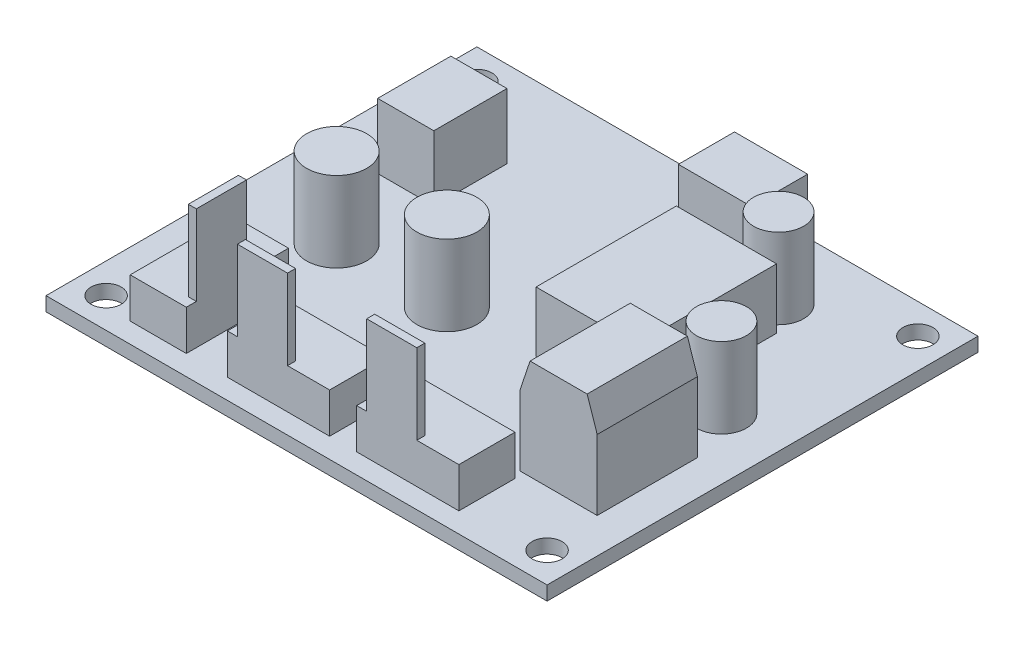
from build123d import *
from OCP.BRepFilletAPI import BRepFilletAPI_MakeChamfer

# Parameters (mm, degrees)
ESQUISSE1_W          = 50
ESQUISSE1_H          = 43
ESQUISSE1_R          = 1.5
BOSS_EXTRU_1_DEPTH   = 1.4
ESQUISSE3_W          = 5.6
ESQUISSE3_H          = 10.2
BOSS_EXTRU_2_DEPTH   = 4
ESQUISSE3_W_2        = 10.2
ESQUISSE3_H_2        = 5.6
BOSS_EXTRU_2_2_DEPTH = 4
BOSS_EXTRU_2_3_DEPTH = 4
ESQUISSE4_W          = 5.6
ESQUISSE4_H          = 7.3
BOSS_EXTRU_3_DEPTH   = 6.5
ESQUISSE4_W_2        = 7.3
ESQUISSE4_H_2        = 5.6
BOSS_EXTRU_3_2_DEPTH = 6.5
ESQUISSE5_W          = 10
ESQUISSE5_H          = 14
BOSS_EXTRU_4_DEPTH   = 6
ESQUISSE6_W          = 7.7
ESQUISSE6_H          = 10
BOSS_EXTRU_5_DEPTH   = 10
ESQUISSE7_R          = 2.5
BOSS_EXTRU_6_DEPTH   = 8
BOSS_EXTRU_6_2_DEPTH = 8
ESQUISSE8_R          = 3
BOSS_EXTRU_7_DEPTH   = 8
BOSS_EXTRU_7_2_DEPTH = 8
ESQUISSE9_W          = 0.8
ESQUISSE9_H          = 5
ESQUISSE9_W_2        = 5
ESQUISSE9_H_2        = 0.8
BOSS_EXTRU_8_DEPTH   = 8
CHANFREIN1_SIZE      = 3
CHANFREIN1_SIZE2     = 1


with BuildPart() as part:
    # Esquisse1 → Boss.-Extru.1 (new body)
    with BuildSketch(Plane(origin=(0, 0, 0), x_dir=(1, 0, 0), z_dir=(0, 1, 0))):
        Rectangle(ESQUISSE1_W, ESQUISSE1_H)
        with Locations(Location((-22, 18.5, 0), (0, 0, 270))):
            Circle(ESQUISSE1_R, mode=Mode.SUBTRACT)
        with Locations(Location((22, 18.5, 0), (0, 0, 90))):
            Circle(ESQUISSE1_R, mode=Mode.SUBTRACT)
        with Locations(Location((22, -18.5, 0), (0, 0, 270))):
            Circle(ESQUISSE1_R, mode=Mode.SUBTRACT)
        with Locations(Location((-22, -18.5, 0), (0, 0, 90))):
            Circle(ESQUISSE1_R, mode=Mode.SUBTRACT)
    extrude(amount=BOSS_EXTRU_1_DEPTH)


with BuildPart() as body_2:
    # Esquisse3 → Boss.-Extru.2 (new body)
    with BuildSketch(Plane(origin=(0, 1.4, 0), x_dir=(1, 0, 0), z_dir=(0, 1, 0))):
        with Locations((-15.8, -14.4)):
            Rectangle(ESQUISSE3_W, ESQUISSE3_H)
    extrude(amount=BOSS_EXTRU_2_DEPTH)



with BuildPart() as body_3:
    # Esquisse3 → Boss.-Extru.2 2 (new body)
    with BuildSketch(Plane(origin=(0, 1.4, 0), x_dir=(1, 0, 0), z_dir=(0, 1, 0))):
        with Locations((-3.8, -16.7)):
            Rectangle(ESQUISSE3_W_2, ESQUISSE3_H_2)
    extrude(amount=BOSS_EXTRU_2_2_DEPTH)


with BuildPart() as body_4:
    # Esquisse3 → Boss.-Extru.2 3 (new body)
    with BuildSketch(Plane(origin=(0, 1.4, 0), x_dir=(1, 0, 0), z_dir=(0, 1, 0))):
        with Locations((9.1, -16.7)):
            Rectangle(ESQUISSE3_W_2, ESQUISSE3_H_2)
    extrude(amount=BOSS_EXTRU_2_3_DEPTH)


with BuildPart() as body_5:
    # Esquisse4 → Boss.-Extru.3 (new body)
    with BuildSketch(Plane(origin=(0, 1.4, 0), x_dir=(1, 0, 0), z_dir=(0, 1, 0))):
        with Locations((-16.2, 9.25)):
            Rectangle(ESQUISSE4_W, ESQUISSE4_H)
    extrude(amount=BOSS_EXTRU_3_DEPTH)


with BuildPart() as body_6:
    # Esquisse4 → Boss.-Extru.3 2 (new body)
    with BuildSketch(Plane(origin=(0, 1.4, 0), x_dir=(1, 0, 0), z_dir=(0, 1, 0))):
        with Locations((5.35, 17.7)):
            Rectangle(ESQUISSE4_W_2, ESQUISSE4_H_2)
    extrude(amount=BOSS_EXTRU_3_2_DEPTH)


with BuildPart() as body_7:
    # Esquisse5 → Boss.-Extru.4 (new body)
    with BuildSketch(Plane(origin=(0, 1.4, 0), x_dir=(1, 0, 0), z_dir=(0, 1, 0))):
        with Locations((9.7, 4.7)):
            Rectangle(ESQUISSE5_W, ESQUISSE5_H)
    extrude(amount=BOSS_EXTRU_4_DEPTH)


with BuildPart() as body_8:
    # Esquisse6 → Boss.-Extru.5 (new body)
    with BuildSketch(Plane(origin=(0, 1.4, 0), x_dir=(1, 0, 0), z_dir=(0, 1, 0))):
        with Locations((17.65, -8)):
            Rectangle(ESQUISSE6_W, ESQUISSE6_H)
    extrude(amount=BOSS_EXTRU_5_DEPTH)

    # Chanfrein1: one chamfer whose edges measure the first distance from different faces: ONE call of the kernel's chamfer builder (chamfer() names one face for all edges)
    chanfrein1_edges_1 = [body_8.edges().sort_by_distance(p)[0] for p in [
        (21.5, 11.4, 8),
    ]]
    chanfrein1_side_1 = [body_8.faces().sort_by_distance(p)[0] for p in [
        (21.5, 6.4, 8),
    ]]
    chanfrein1_edges_2 = [body_8.edges().sort_by_distance(p)[0] for p in [
        (13.8, 11.4, 8),
    ]]
    chanfrein1_side_2 = [body_8.faces().sort_by_distance(p)[0] for p in [
        (13.8, 6.4, 8),
    ]]
    chanfrein1 = BRepFilletAPI_MakeChamfer(body_8.part.solid().wrapped)
    for e in chanfrein1_edges_1:
        chanfrein1.Add(CHANFREIN1_SIZE, CHANFREIN1_SIZE2, e.wrapped, chanfrein1_side_1[0].wrapped)  # the first distance lies on this face
    for e in chanfrein1_edges_2:
        chanfrein1.Add(CHANFREIN1_SIZE, CHANFREIN1_SIZE2, e.wrapped, chanfrein1_side_2[0].wrapped)  # the first distance lies on this face
    add(Compound.cast(chanfrein1.Shape()), mode=Mode.REPLACE)


with BuildPart() as body_9:
    # Esquisse7 → Boss.-Extru.6 (new body)
    with BuildSketch(Plane(origin=(0, 1.4, 0), x_dir=(1, 0, 0), z_dir=(0, 1, 0))):
        with Locations(Location((12.3, 14.3, 0), (0, 0, 270))):
            Circle(ESQUISSE7_R)
    extrude(amount=BOSS_EXTRU_6_DEPTH)


with BuildPart() as body_10:
    # Esquisse7 → Boss.-Extru.6 2 (new body)
    with BuildSketch(Plane(origin=(0, 1.4, 0), x_dir=(1, 0, 0), z_dir=(0, 1, 0))):
        with Locations(Location((18.9, 2, 0), (0, 0, 270))):
            Circle(ESQUISSE7_R)
    extrude(amount=BOSS_EXTRU_6_2_DEPTH)


with BuildPart() as body_11:
    # Esquisse8 → Boss.-Extru.7 (new body)
    with BuildSketch(Plane(origin=(0, 1.4, 0), x_dir=(1, 0, 0), z_dir=(0, 1, 0))):
        with Locations(Location((-15, -2.5, 0), (0, 0, 270))):
            Circle(ESQUISSE8_R)
    extrude(amount=BOSS_EXTRU_7_DEPTH)


with BuildPart() as body_12:
    # Esquisse8 → Boss.-Extru.7 2 (new body)
    with BuildSketch(Plane(origin=(0, 1.4, 0), x_dir=(1, 0, 0), z_dir=(0, 1, 0))):
        with Locations(Location((-4, -2.5, 0), (0, 0, 270))):
            Circle(ESQUISSE8_R)
    extrude(amount=BOSS_EXTRU_7_2_DEPTH)


with BuildPart() as body_2_1:
    add(body_2.part)

    add(body_3.part)  # Boss.-Extru.8 merges body 3

    add(body_4.part)  # Boss.-Extru.8 merges body 4
    # Esquisse9 → Boss.-Extru.8 (add)
    with BuildSketch(Plane(origin=(0, 5.4, 0), x_dir=(1, 0, 0), z_dir=(0, 1, 0))):
        with Locations((-13.4, -16)):
            Rectangle(ESQUISSE9_W, ESQUISSE9_H)
        with Locations((-5.4, -19.1)):
            Rectangle(ESQUISSE9_W_2, ESQUISSE9_H_2)
        with Locations((7.5, -19.1)):
            Rectangle(ESQUISSE9_W_2, ESQUISSE9_H_2)
    extrude(amount=BOSS_EXTRU_8_DEPTH)


solid = Compound([part.part, body_5.part, body_6.part, body_7.part, body_8.part, body_9.part, body_10.part, body_11.part, body_12.part, body_2_1.part])
